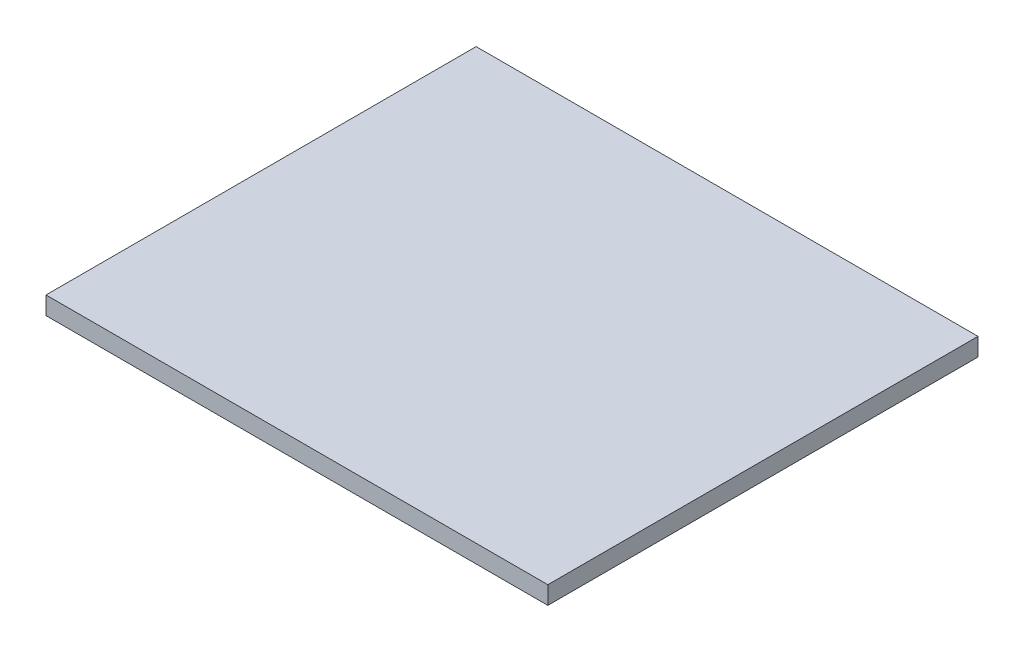
from build123d import *

# Parameters (mm, degrees)
SKETCH1_W           = 177.8
SKETCH1_H           = 152.4
BOSS_EXTRUDE1_DEPTH = 6.35


with BuildPart() as part:
    # Sketch1 → Boss-Extrude1 (new body)
    with BuildSketch(Plane(origin=(0, 0, 0), x_dir=(1, 0, 0), z_dir=(0, 1, 0))):
        Rectangle(SKETCH1_W, SKETCH1_H)
    extrude(amount=BOSS_EXTRUDE1_DEPTH)


solid = part.part
